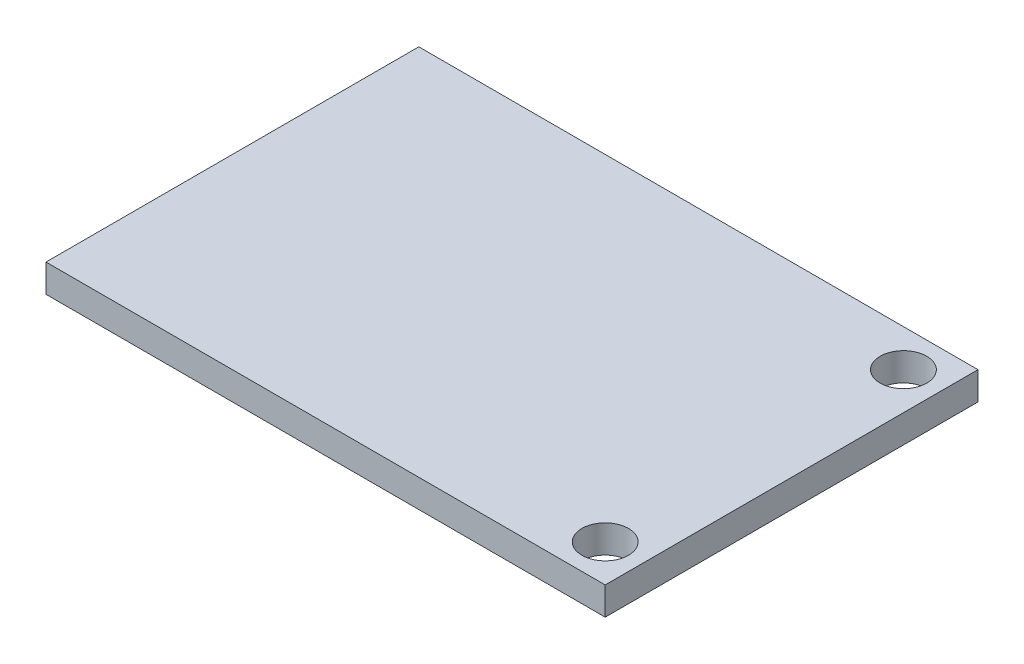
from build123d import *

# Parameters (mm, degrees)
SKETCH1_W           = 30
SKETCH1_H           = 20
BOSS_EXTRUDE1_DEPTH = 1.5
SKETCH2_R           = 1.25
CUT_EXTRUDE1_DEPTH  = 19.090052515


with BuildPart() as part:
    # Sketch1 → Boss-Extrude1 (new body)
    with BuildSketch(Plane(origin=(0, 0, 0), x_dir=(1, 0, 0), z_dir=(0, 1, 0))):
        Rectangle(SKETCH1_W, SKETCH1_H)
    extrude(amount=BOSS_EXTRUDE1_DEPTH)

    # Sketch2 → Cut-Extrude1 (cut, through all)
    with BuildSketch(Plane(origin=(0, 1.5, 0), x_dir=(1, 0, 0), z_dir=(0, 1, 0))):
        with Locations(Location((13, 8, 0), (0, 0, 270))):
            Circle(SKETCH2_R)
        with Locations(Location((13, -8, 0), (0, 0, 270))):
            Circle(SKETCH2_R)
    extrude(amount=-CUT_EXTRUDE1_DEPTH, mode=Mode.SUBTRACT)


solid = part.part
